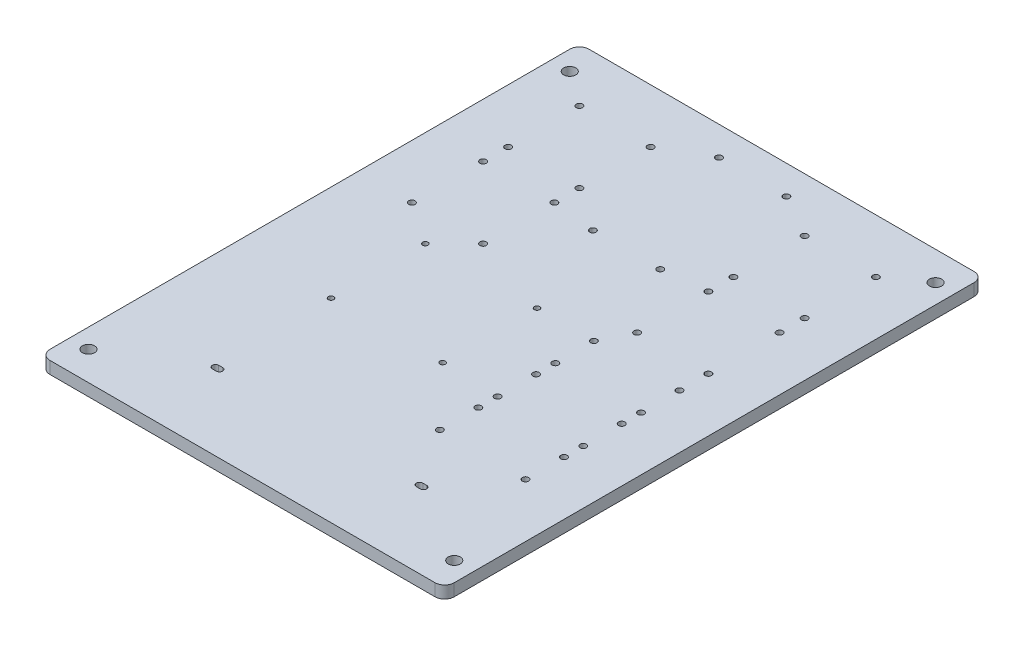
from build123d import *

# Parameters (mm, degrees)
SKETCH1_W               = 210
SKETCH1_H               = 280
BOSS_EXTRUDE1_DEPTH     = 6.35
SKETCH2_R               = 3.15
CUT_EXTRUDE1_DEPTH      = 176.115169246
CUT_EXTRUDE2_DEPTH      = 176.115169246
SKETCH4_R               = 1.65
CUT_EXTRUDE3_DEPTH      = 176.115169246
LPATTERN1_COUNT         = 2
LPATTERN1_PITCH         = 50
MIRROR1_COPY_1_SKETCH_R = 1.65
MIRROR1_COPY_1_DEPTH    = 176.115169246
SKETCH5_R               = 1.4
CUT_EXTRUDE4_DEPTH      = 176.115169246
FILLET1_R               = 5
SKETCH6_R               = 1.65
CUT_EXTRUDE5_DEPTH      = 176.115169246
SKETCH7_R               = 1.65
CUT_EXTRUDE6_DEPTH      = 176.115169246
LPATTERN4_COUNT         = 3
LPATTERN4_PITCH         = 30


with BuildPart() as part:
    # Sketch1 → Boss-Extrude1 (new body)
    with BuildSketch(Plane(origin=(0, 0, 0), x_dir=(1, 0, 0), z_dir=(0, 1, 0))):
        Rectangle(SKETCH1_W, SKETCH1_H)
    extrude(amount=-BOSS_EXTRUDE1_DEPTH)

    # Sketch2 → Cut-Extrude1 (cut, through all)
    with BuildSketch(Plane(origin=(0, 0, 0), x_dir=(1, 0, 0), z_dir=(0, 1, 0))):
        with Locations(Location((-95, 125, 0), (0, 0, 270))):
            Circle(SKETCH2_R)
        with Locations(Location((95, 125, 0), (0, 0, 270))):
            Circle(SKETCH2_R)
        with Locations(Location((-95, -125, 0), (0, 0, 270))):
            Circle(SKETCH2_R)
        with Locations(Location((95, -125, 0), (0, 0, 270))):
            Circle(SKETCH2_R)
    extrude(amount=-CUT_EXTRUDE1_DEPTH, mode=Mode.SUBTRACT)

    # Sketch3 → Cut-Extrude2 (cut, through all)
    with BuildSketch(Plane(origin=(0, 0, 0), x_dir=(1, 0, 0), z_dir=(0, 1, 0))):
        with BuildLine():
            Line((52, -98.35), (54, -98.35))
            ThreePointArc((54, -98.35), (55.65, -100), (54, -101.65))
            Line((54, -101.65), (52, -101.65))
            ThreePointArc((52, -101.65), (50.35, -100), (52, -98.35))
        make_face()
        with BuildLine():
            Line((-54, -98.35), (-52, -98.35))
            ThreePointArc((-52, -98.35), (-50.35, -100), (-52, -101.65))
            Line((-52, -101.65), (-54, -101.65))
            ThreePointArc((-54, -101.65), (-55.65, -100), (-54, -98.35))
        make_face()
    extrude(amount=-CUT_EXTRUDE2_DEPTH, mode=Mode.SUBTRACT)

    # Sketch4 → Cut-Extrude3 (cut, through all)
    with BuildSketch(Plane(origin=(0, 0, 0), x_dir=(1, 0, 0), z_dir=(0, 1, 0))):
        with Locations(Location((40, 112, 0), (0, 0, 270))):
            Circle(SKETCH4_R)
        with Locations(Location((77, 112, 0), (0, 0, 270))):
            Circle(SKETCH4_R)
        with Locations(Location((40, 75, 0), (0, 0, 270))):
            Circle(SKETCH4_R)
        with Locations(Location((77, 75, 0), (0, 0, 270))):
            Circle(SKETCH4_R)
    cut_extrude3 = extrude(amount=-CUT_EXTRUDE3_DEPTH, mode=Mode.SUBTRACT)

    # LPattern1: Cut-Extrude3 ×2
    with Locations(*[(0, 0, i * LPATTERN1_PITCH) for i in range(1, LPATTERN1_COUNT)]):
        add(cut_extrude3, mode=Mode.SUBTRACT)

    # Mirror1: Cut-Extrude3 across plane
    add(cut_extrude3.mirror(Plane(origin=(0, 0, 0), x_dir=(0, 0, 1), z_dir=(1, 0, 0))), mode=Mode.SUBTRACT)

    # Mirror1 copy 1 sketch → Mirror1 copy 1 (cut, through all)
    with BuildSketch(Plane(origin=(0, 0, 50), x_dir=(-1, 0, 0), z_dir=(0, 1, 0))):
        with Locations((40, -112)):
            Circle(MIRROR1_COPY_1_SKETCH_R)
        with Locations((77, -112)):
            Circle(MIRROR1_COPY_1_SKETCH_R)
        with Locations((40, -75)):
            Circle(MIRROR1_COPY_1_SKETCH_R)
        with Locations((77, -75)):
            Circle(MIRROR1_COPY_1_SKETCH_R)
    extrude(amount=-MIRROR1_COPY_1_DEPTH, mode=Mode.SUBTRACT)

    # Sketch5 → Cut-Extrude4 (cut, through all)
    with BuildSketch(Plane(origin=(0, 0, 0), x_dir=(1, 0, 0), z_dir=(0, 1, 0))):
        with Locations(Location((-55, 10, 0), (0, 0, 270))):
            Circle(SKETCH5_R)
        with Locations(Location((3, 10, 0), (0, 0, 270))):
            Circle(SKETCH5_R)
        with Locations(Location((-55, -39, 0), (0, 0, 270))):
            Circle(SKETCH5_R)
        with Locations(Location((3, -39, 0), (0, 0, 270))):
            Circle(SKETCH5_R)
    extrude(amount=-CUT_EXTRUDE4_DEPTH, mode=Mode.SUBTRACT)

    # Fillet1
    fillet1_edges = [part.edges().sort_by_distance(p)[0] for p in [
        (105, -3.175, 140),
        (-105, -3.175, 140),
        (-105, -3.175, -140),
        (105, -3.175, -140),
    ]]
    fillet(fillet1_edges, radius=FILLET1_R)

    # Sketch6 → Cut-Extrude5 (cut, through all)
    with BuildSketch(Plane(origin=(0, 0, 0), x_dir=(1, 0, 0), z_dir=(0, 1, 0))):
        with Locations(Location((-17.5, 125, 0), (0, 0, 270))):
            Circle(SKETCH6_R)
        with Locations(Location((-17.5, 59.5, 0), (0, 0, 270))):
            Circle(SKETCH6_R)
        with Locations(Location((17.5, 59.5, 0), (0, 0, 270))):
            Circle(SKETCH6_R)
        with Locations(Location((17.5, 125, 0), (0, 0, 270))):
            Circle(SKETCH6_R)
    extrude(amount=-CUT_EXTRUDE5_DEPTH, mode=Mode.SUBTRACT)

    # Sketch7 → Cut-Extrude6 (cut, through all)
    with BuildSketch(Plane(origin=(0, 0, 0), x_dir=(1, 0, 0), z_dir=(0, 1, 0))):
        with Locations(Location((32.5, 10, 0), (0, 0, 270))):
            Circle(SKETCH7_R)
        with Locations(Location((77, 10, 0), (0, 0, 270))):
            Circle(SKETCH7_R)
        with Locations(Location((77, -10, 0), (0, 0, 270))):
            Circle(SKETCH7_R)
        with Locations(Location((32.5, -10, 0), (0, 0, 270))):
            Circle(SKETCH7_R)
    cut_extrude6 = extrude(amount=-CUT_EXTRUDE6_DEPTH, mode=Mode.SUBTRACT)

    # LPattern4: Cut-Extrude6 ×3
    with Locations(*[(0, 0, i * LPATTERN4_PITCH) for i in range(1, LPATTERN4_COUNT)]):
        add(cut_extrude6, mode=Mode.SUBTRACT)


solid = part.part
